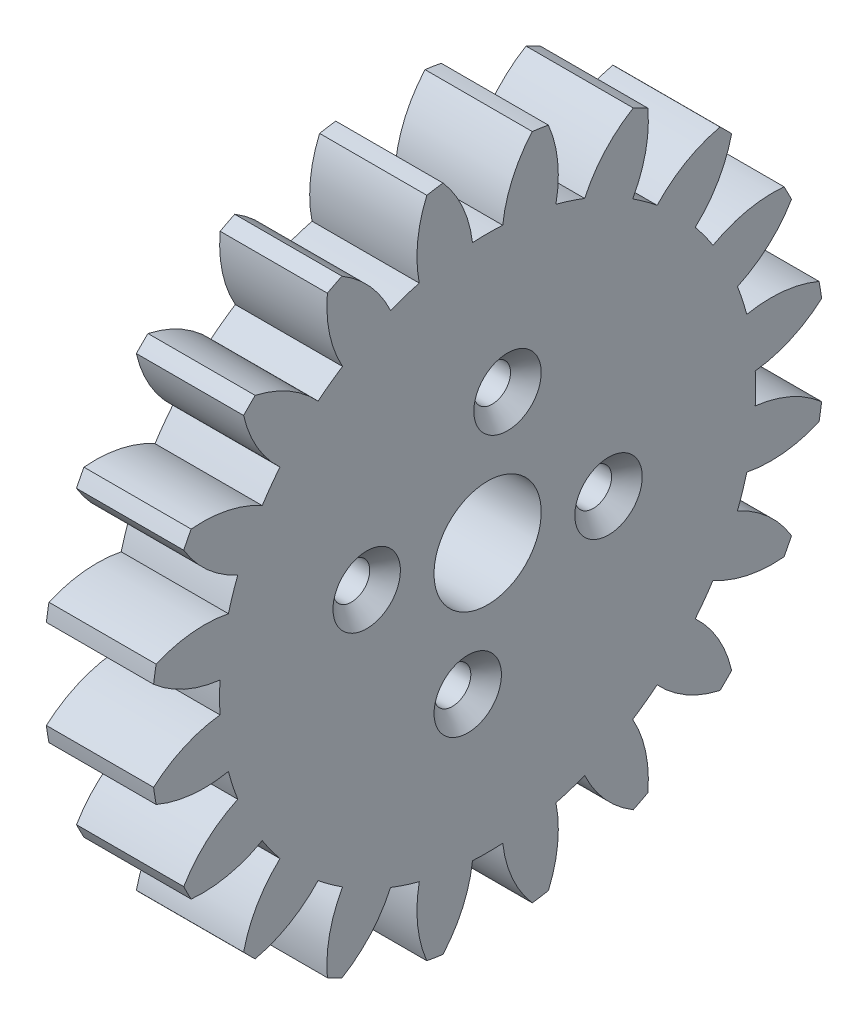
from build123d import *

# Parameters (mm, degrees)
BASPROSKE_W                                    = 7
BASPROSKE_H                                    = 22
TOOTHCUT_DEPTH                                 = 32.890437438
TEETHCUTS_COUNT                                = 20
TEETHCUTS_ANGLE                                = 342
BORSKE_R                                       = 3.5
BORE_DEPTH                                     = 50.0000508
FRAISAGE_POUR_VIS_T_TE_FRAIS_E_M21_D           = 2.4
FRAISAGE_POUR_VIS_T_TE_FRAIS_E_M21_CSINK_D     = 4.4
FRAISAGE_POUR_VIS_T_TE_FRAIS_E_M21_CSINK_ANGLE = 90
R_P_TITION_CIRCULAIRE1_COUNT                   = 4


with BuildPart() as part:
    # BasProSke → Base-Revolve (revolve)
    with BuildSketch(Plane(origin=(0, 0, 0), x_dir=(1, 0, 0), z_dir=(0, 1, 0)), mode=Mode.PRIVATE) as base_revolve_sk:
        with Locations((3.5, 11)):
            Rectangle(BASPROSKE_W, BASPROSKE_H)
    revolve(base_revolve_sk.sketch.rotate(Axis((-10, 0, 0), (1, 0, 0)), 180), axis=Axis((-10, 0, 0), (1, 0, 0)))

    # TooCutSke → ToothCut (cut, through all)
    with BuildSketch(Plane(origin=(0, 0, 0), x_dir=(0, 0, -1), z_dir=(1, 0, 0))):
        with BuildLine():
            ThreePointArc((0.986171591, 17.471189616), (0, 17.499), (-0.986171591, 17.471189616))
            ThreePointArc((-0.986171591, 17.471189616), (-1.626916196, 19.798789858), (-2.932850173, 21.829260982))
            ThreePointArc((-2.932850173, 21.829260982), (0, 22.0254), (2.932850173, 21.829260982))
            ThreePointArc((2.932850173, 21.829260982), (1.626916196, 19.798789858), (0.986171591, 17.471189616))
        make_face()
    toothcut = extrude(amount=TOOTHCUT_DEPTH, mode=Mode.SUBTRACT)

    # TeethCuts: ToothCut ×20 about axis
    teethcuts_axis = Axis((-10, 0, 0), (1, 0, 0))
    for i in range(1, TEETHCUTS_COUNT):
        add(toothcut.rotate(teethcuts_axis, i * TEETHCUTS_ANGLE / (TEETHCUTS_COUNT - 1)), mode=Mode.SUBTRACT)

    # BorSke → Bore (cut, symmetric)
    with BuildSketch(Plane(origin=(0, 0, 0), x_dir=(0, 0, -1), z_dir=(1, 0, 0))):
        with Locations(Location((0, 0, 0), (0, 0, 180))):
            Circle(BORSKE_R)
    extrude(amount=BORE_DEPTH, both=True, mode=Mode.SUBTRACT)

    # Fraisage pour vis à tête fraisée M21 (through all)
    with Locations(Plane(origin=(7, 0, 0), x_dir=(0, 0, -1), z_dir=(1, 0, 0))):
        with Locations((1.298006129, 7.893996459)):
            fraisage_pour_vis_t_te_frais_e_m21 = CounterSinkHole(FRAISAGE_POUR_VIS_T_TE_FRAIS_E_M21_D / 2, FRAISAGE_POUR_VIS_T_TE_FRAIS_E_M21_CSINK_D / 2, counter_sink_angle=FRAISAGE_POUR_VIS_T_TE_FRAIS_E_M21_CSINK_ANGLE)

    # Répétition circulaire1: Fraisage pour vis à tête fraisée M21 ×4 about axis
    r_p_tition_circulaire1_axis = Axis((0, 0, 0), (1, 0, 0))
    for i in range(1, R_P_TITION_CIRCULAIRE1_COUNT):
        add(fraisage_pour_vis_t_te_frais_e_m21.rotate(r_p_tition_circulaire1_axis, i * 360 / R_P_TITION_CIRCULAIRE1_COUNT), mode=Mode.SUBTRACT)


solid = part.part
